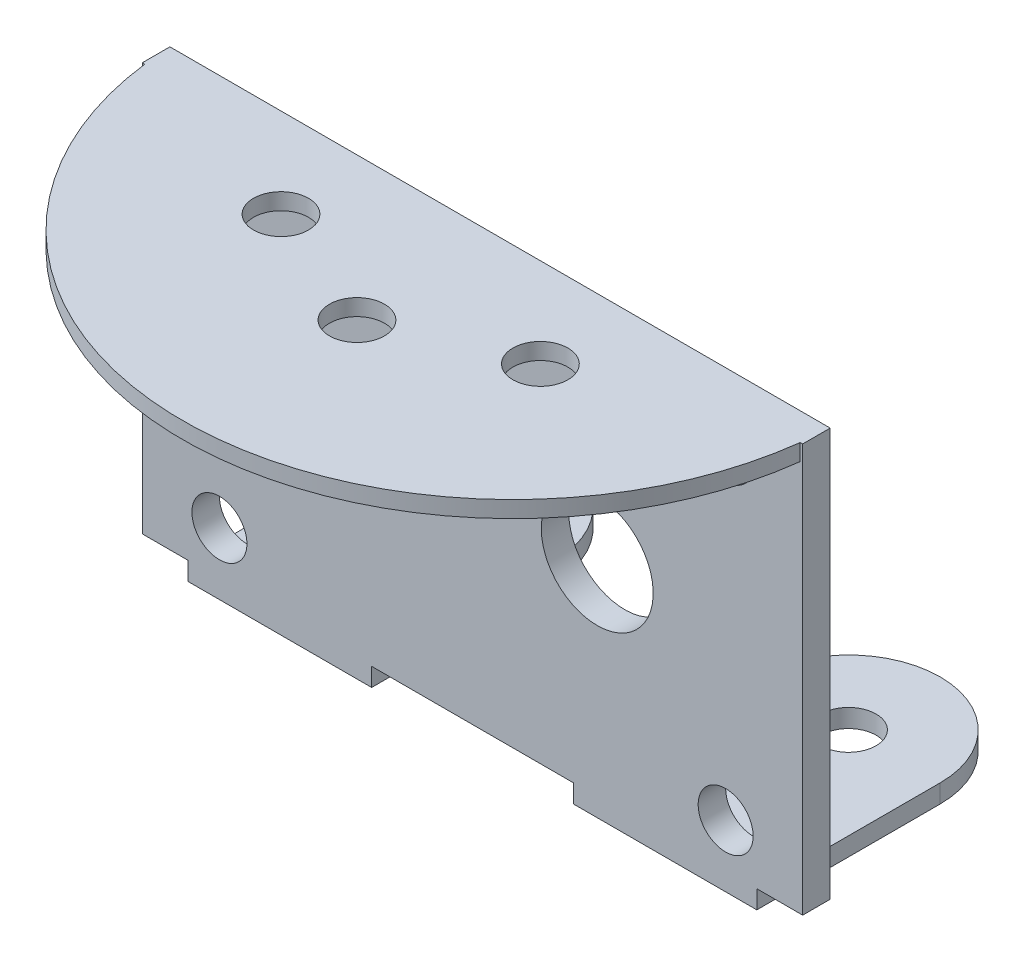
from build123d import *

# Parameters (mm, degrees)
CROQUIS1_W              = 36
CROQUIS1_H              = 22.25
CROQUIS1_R              = 1.5
CROQUIS1_R_2            = 3.05
CROQUIS1_R_3            = 1.875
SALIENTE_EXTRUIR1_DEPTH = 1.5
CROQUIS2_R              = 1.5
CROQUIS2_W              = 10
CROQUIS2_H              = 1.5
SALIENTE_EXTRUIR2_DEPTH = 1
CROQUIS3_R              = 1.500000001
CROQUIS3_R_2            = 1.5
SALIENTE_EXTRUIR6_DEPTH = 0.9


with BuildPart() as part:
    # Croquis1 → Saliente-Extruir1 (new body)
    with BuildSketch(Plane.XY):
        Rectangle(CROQUIS1_W, CROQUIS1_H)
        with Locations((13.8, 8.745)):
            Circle(CROQUIS1_R, mode=Mode.SUBTRACT)
        with Locations(Location((13.8, -8.745, 0), (0, 0, 180))):
            Circle(CROQUIS1_R, mode=Mode.SUBTRACT)
        with Locations(Location((6.8, 0, 0), (0, 0, 180))):
            Circle(CROQUIS1_R_2, mode=Mode.SUBTRACT)
        with Locations((-13.8, -8.745)):
            Circle(CROQUIS1_R, mode=Mode.SUBTRACT)
        with Locations(Location((-13.8, 8.745, 0), (0, 0, 180))):
            Circle(CROQUIS1_R, mode=Mode.SUBTRACT)
        with Locations(Location((-4.2, 0, 0), (0, 0, 180))):
            Circle(CROQUIS1_R_3, mode=Mode.SUBTRACT)
    extrude(amount=SALIENTE_EXTRUIR1_DEPTH)

    # Croquis2 → Saliente-Extruir2 (add)
    # profile 1 of 4: a face of its own
    with BuildSketch(Plane.XZ.offset(11.125)):
        with BuildLine():
            Line((-5.5, -8.5), (-5.5, 0))
            Line((-5.5, 0), (-15.5, 0))
            Line((-15.5, 0), (-15.5, -8.5))
            ThreePointArc((-15.5, -8.5), (-10.5, -13.5), (-5.5, -8.5))
        make_face()
        with Locations((-10.5, -8.5)):
            Circle(CROQUIS2_R, mode=Mode.SUBTRACT)
    # profile 2 of 4: a face of its own
    with BuildSketch(Plane.XZ.offset(11.125)):
        with Locations((-10.5, 0.75)):
            Rectangle(CROQUIS2_W, CROQUIS2_H)
    # profile 3 of 4: a face of its own
    with BuildSketch(Plane.XZ.offset(11.125)):
        with BuildLine():
            Line((15.5, 0), (5.5, 0))
            Line((5.5, 0), (5.5, -8.5))
            ThreePointArc((5.5, -8.5), (10.5, -13.5), (15.5, -8.5))
            Line((15.5, -8.5), (15.5, 0))
        make_face()
        with Locations((10.5, -8.5)):
            Circle(CROQUIS2_R, mode=Mode.SUBTRACT)
    # profile 4 of 4: a face of its own
    with BuildSketch(Plane.XZ.offset(11.125)):
        with Locations((10.5, 0.75)):
            Rectangle(CROQUIS2_W, CROQUIS2_H)
    extrude(amount=SALIENTE_EXTRUIR2_DEPTH)

    # Croquis3 → Saliente-Extruir6 (add)
    # profile 1 of 2: a face of its own
    with BuildSketch(Plane(origin=(0, 11.125, 0), x_dir=(1, 0, 0), z_dir=(0, 1, 0))):
        with BuildLine():
            ThreePointArc((-17.865049678, -1.5), (0, -17.3), (17.865049678, -1.5))
            Line((17.865049678, -1.5), (-17.865049678, -1.5))
        make_face()
        with Locations(Location((-7.071067812, -4.871067812, 0), (0, 0, 180))):
            Circle(CROQUIS3_R, mode=Mode.SUBTRACT)
        with Locations(Location((0, -7.8, 0), (0, 0, 180))):
            Circle(CROQUIS3_R_2, mode=Mode.SUBTRACT)
        with Locations(Location((7.071067812, -4.871067812, 0), (0, 0, 180))):
            Circle(CROQUIS3_R_2, mode=Mode.SUBTRACT)
    # profile 2 of 2: a face of its own
    with BuildSketch(Plane(origin=(0, 11.125, 0), x_dir=(1, 0, 0), z_dir=(0, 1, 0))):
        with BuildLine():
            ThreePointArc((17.865049678, -1.5), (17.941399597, -0.751268579), (17.986383739, 0))
            Line((17.986383739, 0), (-17.986383739, 0))
            ThreePointArc((-17.986383739, 0), (-17.941399597, -0.751268579), (-17.865049678, -1.5))
            Line((-17.865049678, -1.5), (17.865049678, -1.5))
        make_face()
    extrude(amount=-SALIENTE_EXTRUIR6_DEPTH)


solid = part.part
